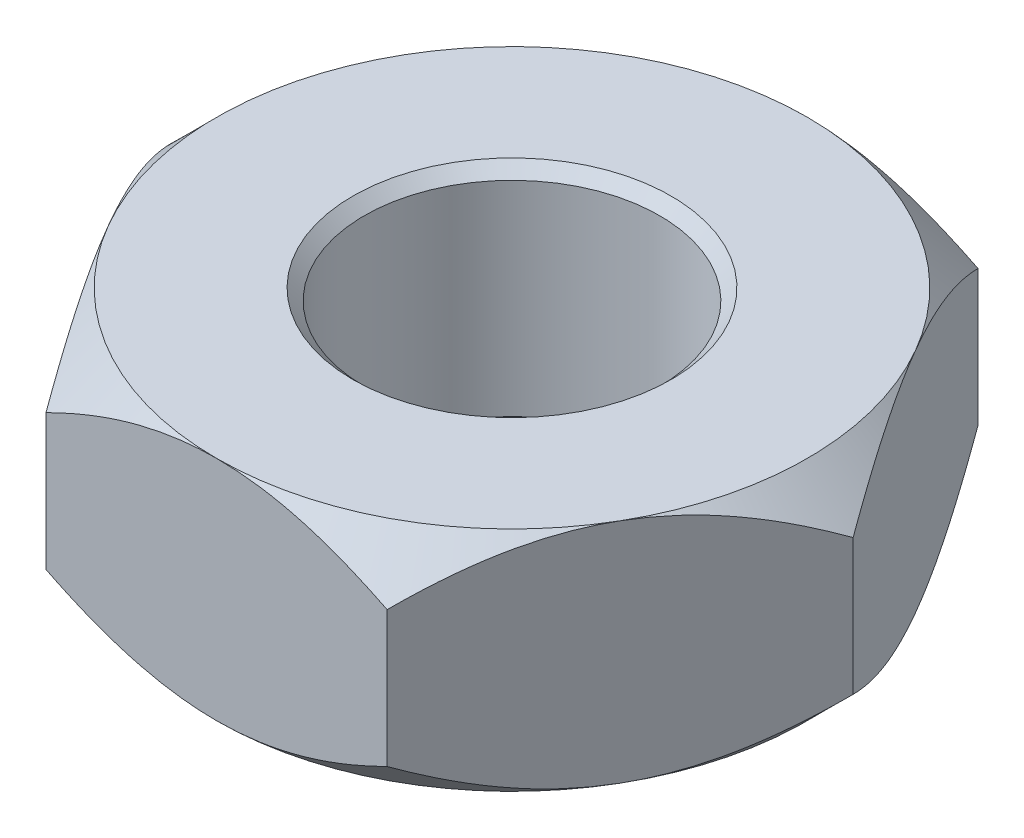
from build123d import *

# Parameters (mm, degrees)
SKETCH1_R           = 3.25
BOSS_EXTRUDE1_DEPTH = 5
CHAMFER2_SIZE       = 0.25


with BuildPart() as part:
    # Sketch1 → Boss-Extrude1 (new body)
    with BuildSketch(Plane(origin=(0, 0, 0), x_dir=(1, 0, 0), z_dir=(0, 1, 0))):
        Polygon((-3.75277675, -6.5), (3.75277675, -6.5), (7.505553499, 0), (3.75277675, 6.5), (-3.75277675, 6.5), (-7.505553499, 0), align=None)
        with Locations(Location((0, 0, 0), (0, 0, 270))):
            Circle(SKETCH1_R, mode=Mode.SUBTRACT)
    extrude(amount=BOSS_EXTRUDE1_DEPTH)

    # Sketch2 → Cut-Revolve1 (revolve, cut)
    with BuildSketch(Plane(origin=(0, 0, 0), x_dir=(0, 0, -1), z_dir=(1, 0, 0))):
        Polygon((6.5, 5), (7.55, 6.05), (7.55, 3.95), align=None)
        Polygon((7.55, 1.05), (6.5, 0), (7.55, -1.05), align=None)
    revolve(axis=Axis((0, 5, 0), (0, -1, 0)), mode=Mode.SUBTRACT)

    # Chamfer2
    chamfer2_edges = [part.edges().sort_by_distance(p)[0] for p in [
        (0, 0, -3.25),
        (0, 5, -3.25),
    ]]
    chamfer(chamfer2_edges, length=CHAMFER2_SIZE)


solid = part.part
